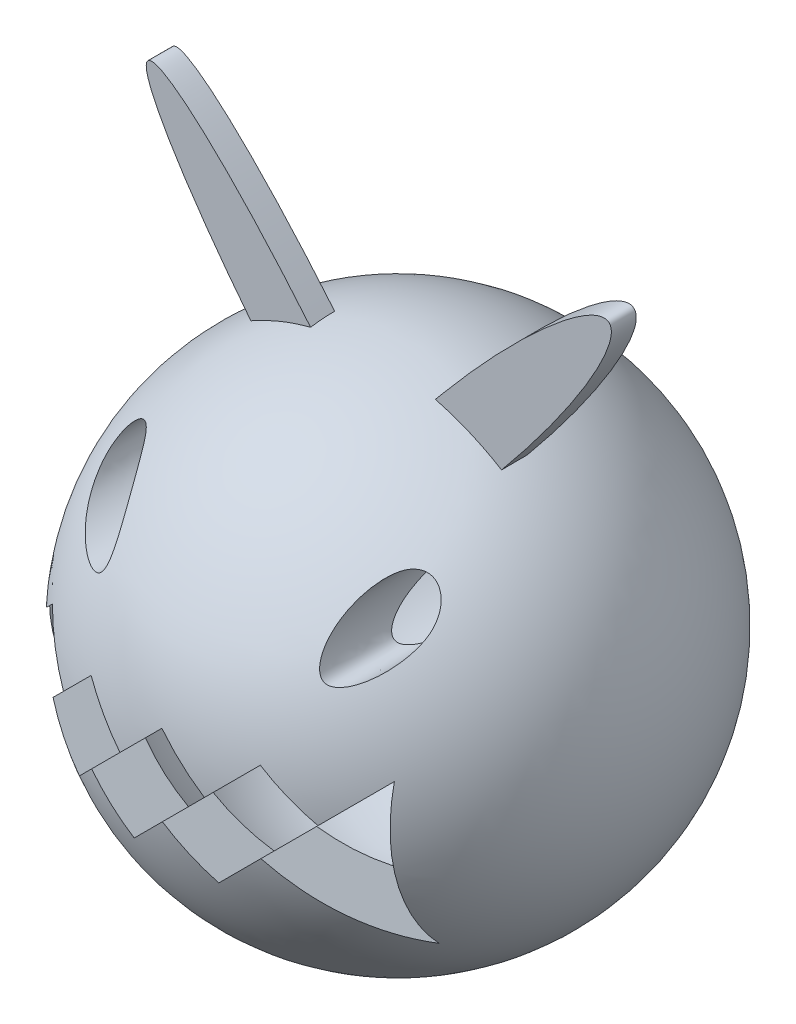
from build123d import *

# Parameters (mm, degrees)
CUT_EXTRUDE1_DEPTH  = 50
CUT_EXTRUDE2_DEPTH  = 50
BOSS_EXTRUDE1_DEPTH = 5
BOSS_EXTRUDE2_DEPTH = 5


with BuildPart() as part:
    # Sketch4 → Revolve-Thin1 (revolve)
    with BuildSketch(Plane.XY):
        with BuildLine():
            ThreePointArc((0, 48.490566038), (50, -1.509433962), (0, -51.509433962))
            Line((0, -51.509433962), (0, -41.509433962))
            ThreePointArc((0, -41.509433962), (40, -1.509433962), (0, 38.490566038))
            Line((0, 38.490566038), (0, 48.490566038))
        make_face()
    revolve(axis=Axis((0, 48.490566038, 0), (0, -1, 0)))

    # Sketch5 → Cut-Extrude1 (cut)
    with BuildSketch(Plane.XY):
        Polygon((-30.644001245, -9.970067303), (-40.033240684, -26.272263251), (-40.033240684, 6.332128646), (-36.976129891, 0), (-30.644001245, 6.332128646), (-22.492903271, -1.818969328), (-14.341805297, 6.332128646), (-6.190707322, -1.818969328), (1.960390652, 6.332128646), (10.111488626, -1.818969328), (18.262586601, 6.332128646), (26.413684575, -1.818969328), (34.56478255, 6.332128646), (34.56478255, -9.970067303), (34.56478255, -26.272263251), (26.413684575, -18.121165277), (18.262586601, -9.970067303), (10.111488626, -18.121165277), (1.960390652, -9.970067303), (-6.190707322, -18.121165277), (-14.341805297, -9.970067303), (-22.492903271, -18.121165277), align=None)
    extrude(amount=CUT_EXTRUDE1_DEPTH, mode=Mode.SUBTRACT)

    # Sketch6 → Cut-Extrude2 (cut)
    with BuildSketch(Plane.XY):
        with BuildLine():
            add(Edge.make_bspline(
                [(-31.159893522, 26.245570533), (-30.561812418, 20.967271985), (-10.609739532, 12.440512153), (-22.402808053, 39.879513697), (-31.550689585, 29.694497906), (-31.159893522, 26.245570533)],
                knots=[0, 0, 0, 0, 0.370756889, 0.75774133, 1, 1, 1, 1], degree=3))
        make_face()
        with BuildLine():
            add(Edge.make_bspline(
                [(23.937401646, 19.642149389), (26.561792049, 18.17132991), (37.050887315, 25.488164902), (23.054790304, 40.061439696), (20.519151547, 21.557881447), (23.937401646, 19.642149389)],
                knots=[0, 0, 0, 0, 0.312357954, 0.593155955, 1, 1, 1, 1], degree=3))
        make_face()
    extrude(amount=CUT_EXTRUDE2_DEPTH, mode=Mode.SUBTRACT)

    # Sketch8 → Boss-Extrude1 (add)
    with BuildSketch(Plane.XY):
        with BuildLine():
            Line((-21.178417491, 37.628203487), (-11.569674779, 45.482179937))
            add(Edge.make_bspline(
                [(-11.569674779, 45.482179937), (-40.321950535, 80.658402053), (-45.12632189, 76.731413828), (-49.930693246, 72.804425603), (-21.178417491, 37.628203487)],
                knots=[4.71238898, 4.71238898, 4.71238898, 6.283185307, 6.283185307, 7.853981634, 7.853981634, 7.853981634], degree=2, weights=[1, 0.707106781, 1, 0.707106781, 1]))
        make_face()
    extrude(amount=BOSS_EXTRUDE1_DEPTH)

    # Sketch9 → Boss-Extrude2 (add)
    with BuildSketch(Plane.XY):
        with BuildLine():
            Line((14.416361682, 48.876227224), (6.987253857, 40.013654036))
            Line((6.987253857, 40.013654036), (17.559883218, 31.151080848))
            Line((17.559883218, 31.151080848), (24.988991043, 40.013654036))
            add(Edge.make_bspline(
                [(24.988991043, 40.013654036), (52.645598361, 73.0066745), (47.35928368, 77.437961094), (42.072969, 81.869247688), (14.416361682, 48.876227224)],
                knots=[4.71238898, 4.71238898, 4.71238898, 6.283185307, 6.283185307, 7.853981634, 7.853981634, 7.853981634], degree=2, weights=[1, 0.707106781, 1, 0.707106781, 1]))
        make_face()
    extrude(amount=BOSS_EXTRUDE2_DEPTH)


solid = part.part
